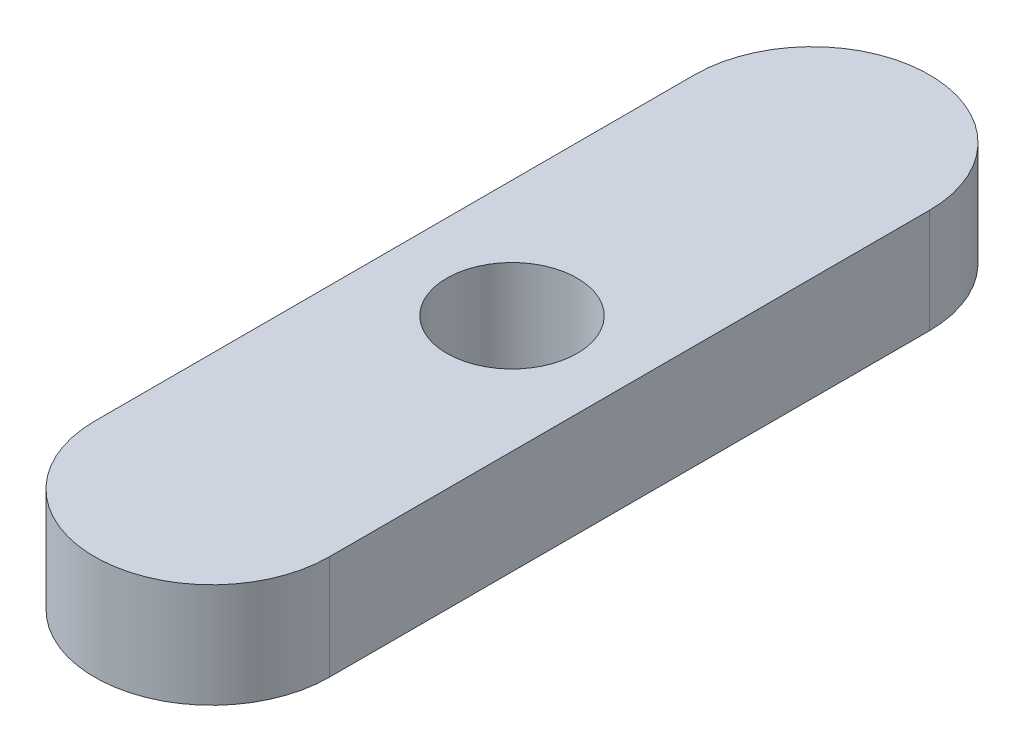
from build123d import *

# Parameters (mm, degrees)
SKETCH1_R           = 1
BOSS_EXTRUDE1_DEPTH = 2
MOVE_FACE1_BY       = 0.25


with BuildPart() as part:
    # Sketch1 → Boss-Extrude1 (new body)
    with BuildSketch(Plane(origin=(0, 0, 0), x_dir=(1, 0, 0), z_dir=(0, 1, 0))):
        with BuildLine():
            Line((-2.25, 0), (-2.25, 11.5))
            ThreePointArc((-2.25, 11.5), (0, 13.75), (2.25, 11.5))
            Line((2.25, 11.5), (2.25, 0))
            ThreePointArc((2.25, 0), (0, -2.25), (-2.25, 0))
        make_face()
        with Locations(Location((0, 5.75, 0), (0, 0, 270))):
            Circle(SKETCH1_R, mode=Mode.SUBTRACT)
    extrude(amount=BOSS_EXTRUDE1_DEPTH)

    # Move Face1: a curved face moved inward by 0.25
    add(Solid.thicken(part.faces().sort_by_distance((0, 1, -6.75))[0], -MOVE_FACE1_BY), mode=Mode.SUBTRACT)


solid = part.part
